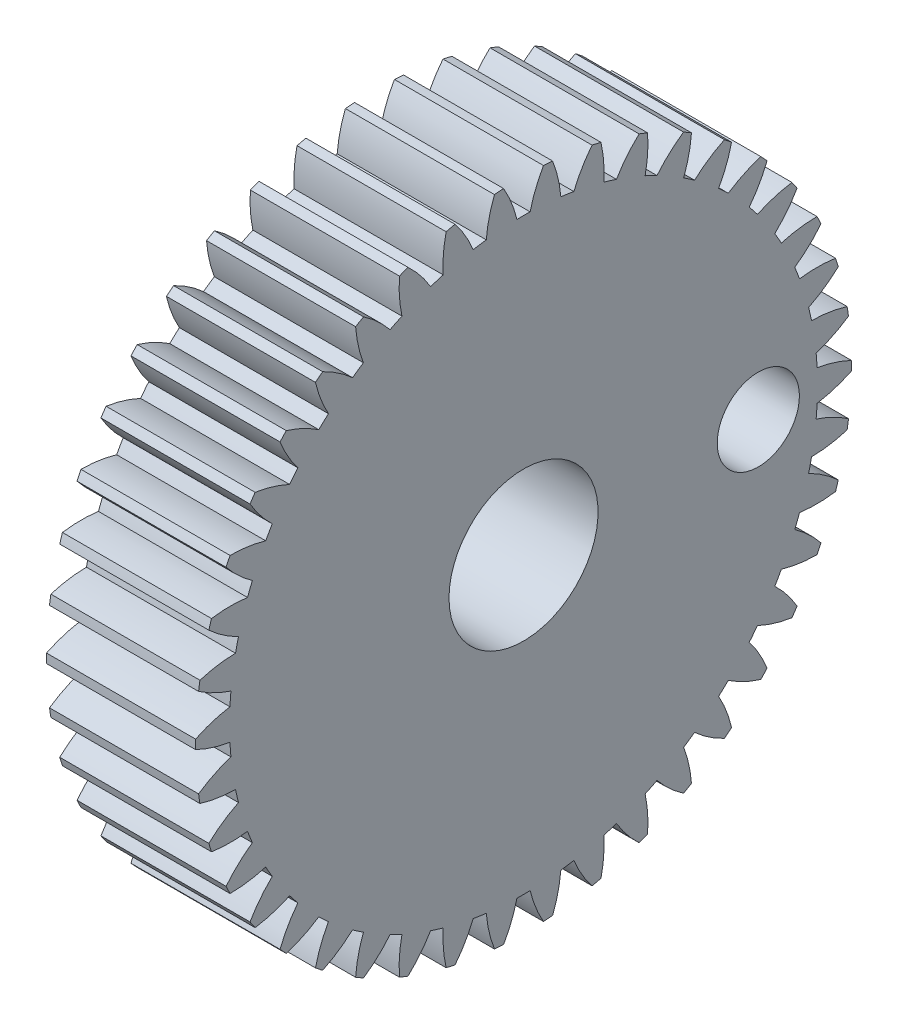
from build123d import *

# Parameters (mm, degrees)
BASPROSKE_W        = 6.35
BASPROSKE_H        = 13.97
TOOTHCUT_DEPTH     = 21.751970991
TEETHCUTS_COUNT    = 42
TEETHCUTS_ANGLE    = 351.428571429
BORSKE_R           = 3.175
BORE_DEPTH         = 50.8000508
SKETCH1_R          = 1.75
SKETCH1_R_2        = 3.175
CUT_EXTRUDE1_DEPTH = 21.734568149


with BuildPart() as part:
    # BasProSke → Base-Revolve (revolve)
    with BuildSketch(Plane(origin=(0, 0, 0), x_dir=(1, 0, 0), z_dir=(0, 1, 0)), mode=Mode.PRIVATE) as base_revolve_sk:
        with Locations((3.175, 6.985)):
            Rectangle(BASPROSKE_W, BASPROSKE_H)
    revolve(base_revolve_sk.sketch.rotate(Axis((-10, 0, 0), (1, 0, 0)), 180), axis=Axis((-10, 0, 0), (1, 0, 0)))

    # TooCutSke → ToothCut (cut, through all)
    with BuildSketch(Plane(origin=(0, 0, 0), x_dir=(0, 0, -1), z_dir=(1, 0, 0))):
        with BuildLine():
            ThreePointArc((0.280922427, 12.519048503), (0, 12.5222), (-0.280922427, 12.519048503))
            ThreePointArc((-0.280922427, 12.519048503), (-0.519083904, 13.265343066), (-0.86398515, 13.968706126))
            ThreePointArc((-0.86398515, 13.968706126), (0, 13.9954), (0.86398515, 13.968706126))
            ThreePointArc((0.86398515, 13.968706126), (0.519083904, 13.265343066), (0.280922427, 12.519048503))
        make_face()
    toothcut = extrude(amount=TOOTHCUT_DEPTH, mode=Mode.SUBTRACT)

    # TeethCuts: ToothCut ×42 about axis
    teethcuts_axis = Axis((-10, 0, 0), (1, 0, 0))
    for i in range(1, TEETHCUTS_COUNT):
        add(toothcut.rotate(teethcuts_axis, i * TEETHCUTS_ANGLE / (TEETHCUTS_COUNT - 1)), mode=Mode.SUBTRACT)

    # BorSke → Bore (cut, symmetric)
    with BuildSketch(Plane(origin=(0, 0, 0), x_dir=(0, 0, -1), z_dir=(1, 0, 0))):
        with Locations(Location((0, 0, 0), (0, 0, 180))):
            Circle(BORSKE_R)
    extrude(amount=BORE_DEPTH, both=True, mode=Mode.SUBTRACT)

    # Sketch1 → Cut-Extrude1 (cut, through all)
    with BuildSketch(Plane(origin=(6.35, 0, 0), x_dir=(0, 0, -1), z_dir=(1, 0, 0))):
        with Locations((10, 0)):
            Circle(SKETCH1_R)
        with Locations(Location((0, 0, 0), (0, 0, 180))):
            Circle(SKETCH1_R_2)
    extrude(amount=-CUT_EXTRUDE1_DEPTH, mode=Mode.SUBTRACT)


solid = part.part
